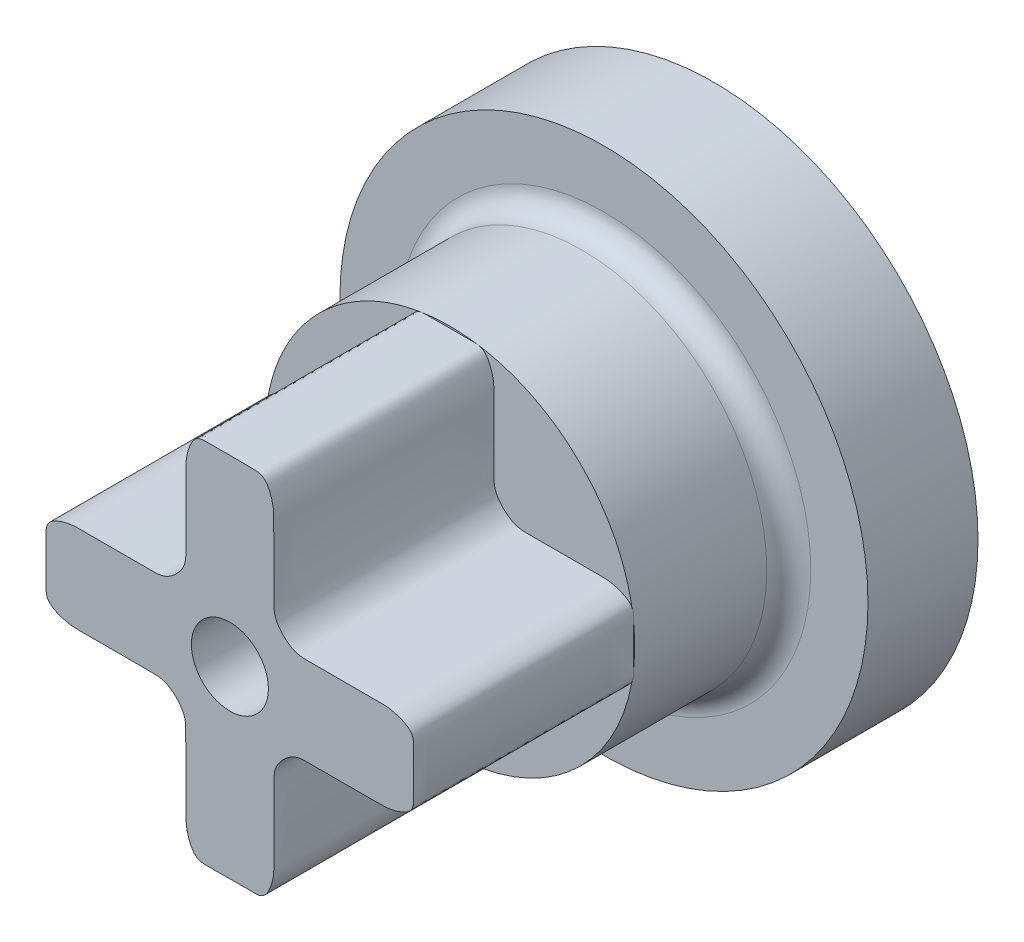
from build123d import *

# Parameters (mm, degrees)
SKETCH1_R           = 8.4
BOSS_EXTRUDE1_DEPTH = 12
BOSS_EXTRUDE2_DEPTH = 10
SKETCH3_R           = 12
BOSS_EXTRUDE3_DEPTH = 5
SKETCH4_R           = 10.25
CUT_EXTRUDE1_DEPTH  = 2.5
SKETCH5_R           = 4.5
CUT_EXTRUDE2_DEPTH  = 2.5
FILLET1_R           = 1
SKETCH6_R           = 3
CUT_EXTRUDE3_DEPTH  = 3
SKETCH7_R           = 1.75
CUT_EXTRUDE4_DEPTH  = 14.5


with BuildPart() as part:
    # Sketch1 → Boss-Extrude1 (new body)
    with BuildSketch(Plane.XY):
        Circle(SKETCH1_R)
    extrude(amount=BOSS_EXTRUDE1_DEPTH)

    # Sketch2 → Boss-Extrude2 (add)
    with BuildSketch(Plane.XY.offset(12)):
        with BuildLine():
            add(Edge.make_bspline(
                [(-1, 8.316702227), (-0.333333333, 8.316702227), (0.333333333, 8.316702227), (1, 8.316702227), (1.207685524, 8.316702227), (1.623056573, 8.316702227), (2, 7.360583243), (2, 6.945212195), (2, 6.73752667), (2, 5.684742966), (2, 4.631959261), (2, 3.579175557), (2, 3.33042954), (2, 2.832937508), (2.840597039, 2), (3.338089071, 2), (3.586835088, 2), (4.644725146, 2), (5.702615205, 2), (6.760505263, 2), (6.968910306, 2), (7.38572039, 2), (8.347340351, 1.625215127), (8.347340351, 1.208405042), (8.347340351, 1), (8.347340351, 0.333333333), (8.347340351, -0.333333333), (8.347340351, -1), (8.347340351, -1.208405042), (8.347340351, -1.625215127), (7.38572039, -2), (6.968910306, -2), (6.760505263, -2), (5.702615205, -2), (4.644725146, -2), (3.586835088, -2), (3.337278981, -2), (2.838166766, -2), (2, -2.840826159), (2, -3.339938373), (2, -3.58949448), (2, -4.649157467), (2, -5.708820453), (2, -6.76848344), (2, -6.977138531), (2, -7.394448713), (1.625965273, -8.35797792), (1.208655091, -8.35797792), (1, -8.35797792), (0.333333333, -8.35797792), (-0.333333333, -8.35797792), (-1, -8.35797792), (-1.208655091, -8.35797792), (-1.625965273, -8.35797792), (-2, -7.394448713), (-2, -6.977138531), (-2, -6.76848344), (-2, -5.708820453), (-2, -4.649157467), (-2, -3.58949448), (-2, -3.339736085), (-2, -2.840219295), (-2.84013572, -2), (-3.33965251, -2), (-3.589410905, -2), (-4.649018174, -2), (-5.708625444, -2), (-6.768232714, -2), (-6.976879945, -2), (-7.394174407, -2), (-8.357643618, -1.625941693), (-8.357643618, -1.208647231), (-8.357643618, -1), (-8.357643618, -0.333333333), (-8.357643618, 0.333333333), (-8.357643618, 1), (-8.357643618, 1.208647231), (-8.357643618, 1.625941693), (-7.394174407, 2), (-6.976879945, 2), (-6.768232714, 2), (-5.708625444, 2), (-4.649018174, 2), (-3.589410905, 2), (-3.340461942, 2), (-2.842564017, 2), (-2, 2.832328669), (-2, 3.330226594), (-2, 3.579175557), (-2, 4.631959261), (-2, 5.684742966), (-2, 6.73752667), (-2, 6.945212195), (-2, 7.360583243), (-1.623056573, 8.316702227), (-1.207685524, 8.316702227), (-1, 8.316702227)],
                knots=[0, 0, 0, 0, 0.03487126, 0.03487126, 0.03487126, 0.045734643, 0.056598027, 0.067461411, 0.067461411, 0.067461411, 0.122529252, 0.122529252, 0.122529252, 0.135540382, 0.148551513, 0.161562643, 0.161562643, 0.161562643, 0.216897581, 0.216897581, 0.216897581, 0.227798601, 0.23869962, 0.24960064, 0.24960064, 0.24960064, 0.2844719, 0.2844719, 0.2844719, 0.295372919, 0.306273939, 0.317174958, 0.317174958, 0.317174958, 0.372509897, 0.372509897, 0.372509897, 0.3855634, 0.398616904, 0.411670408, 0.411670408, 0.411670408, 0.467098082, 0.467098082, 0.467098082, 0.478012181, 0.48892628, 0.499840379, 0.499840379, 0.499840379, 0.534711638, 0.534711638, 0.534711638, 0.545625737, 0.556539836, 0.567453935, 0.567453935, 0.567453935, 0.62288161, 0.62288161, 0.62288161, 0.635945694, 0.649009779, 0.662073864, 0.662073864, 0.662073864, 0.717498624, 0.717498624, 0.717498624, 0.728412312, 0.739326, 0.750239687, 0.750239687, 0.750239687, 0.785110947, 0.785110947, 0.785110947, 0.796024635, 0.806938322, 0.81785201, 0.81785201, 0.81785201, 0.87327677, 0.87327677, 0.87327677, 0.886298516, 0.899320262, 0.912342008, 0.912342008, 0.912342008, 0.967409849, 0.967409849, 0.967409849, 0.978273232, 0.989136616, 1, 1, 1, 1], degree=3))
        make_face()
    extrude(amount=BOSS_EXTRUDE2_DEPTH)

    # Sketch3 → Boss-Extrude3 (add)
    with BuildSketch(Plane(origin=(0, 0, 0), x_dir=(-1, 0, 0), z_dir=(0, 0, -1))):
        Circle(SKETCH3_R)
    extrude(amount=-BOSS_EXTRUDE3_DEPTH)

    # Sketch4 → Cut-Extrude1 (cut)
    with BuildSketch(Plane(origin=(0, 0, 0), x_dir=(-1, 0, 0), z_dir=(0, 0, -1))):
        Circle(SKETCH4_R)
    extrude(amount=-CUT_EXTRUDE1_DEPTH, mode=Mode.SUBTRACT)

    # Sketch5 → Cut-Extrude2 (cut)
    with BuildSketch(Plane(origin=(0, 0, 2.5), x_dir=(-1, 0, 0), z_dir=(0, 0, -1))):
        Circle(SKETCH5_R)
    extrude(amount=-CUT_EXTRUDE2_DEPTH, mode=Mode.SUBTRACT)

    # Fillet1
    fillet1_edges = [part.edges().sort_by_distance(p)[0] for p in [
        (-8.4, 0, 5),
    ]]
    fillet(fillet1_edges, radius=FILLET1_R)

    # Sketch6 → Cut-Extrude3 (cut)
    with BuildSketch(Plane(origin=(0, 0, 5), x_dir=(-1, 0, 0), z_dir=(0, 0, -1))):
        Circle(SKETCH6_R)
    extrude(amount=-CUT_EXTRUDE3_DEPTH, mode=Mode.SUBTRACT)

    # Sketch7 → Cut-Extrude4 (cut)
    with BuildSketch(Plane(origin=(0, 0, 8), x_dir=(-1, 0, 0), z_dir=(0, 0, -1))):
        Circle(SKETCH7_R)
    extrude(amount=-CUT_EXTRUDE4_DEPTH, mode=Mode.SUBTRACT)


solid = part.part
